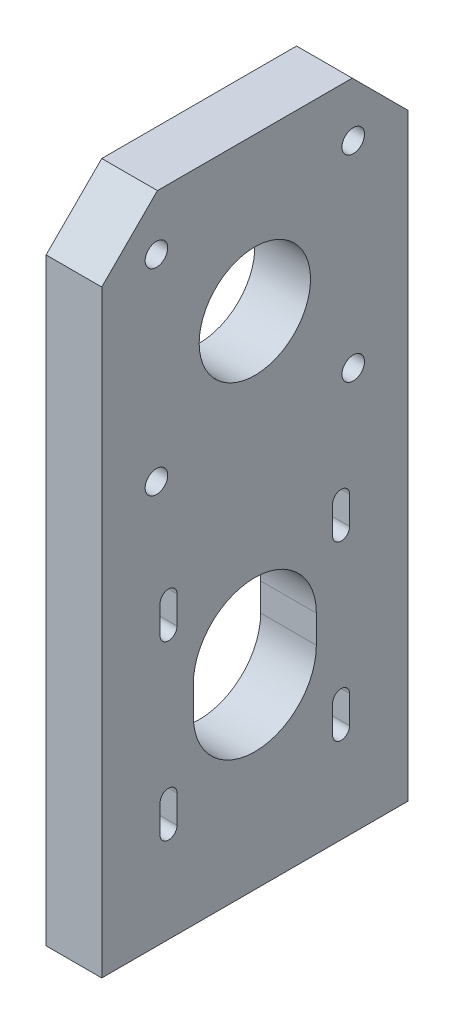
from build123d import *

# Parameters (mm, degrees)
SKETCH_1_R          = 2
SKETCH_1_R_2        = 1.5
SKETCH_1_W          = 10
SKETCH_1_H          = 55
EXTRUDE_1_DEPTH     = 10
SKETCH_2_W          = 10
SKETCH_2_H          = 55
EXTRUDE_2_DEPTH     = 117.5
SKETCH_3_R          = 2.025
SKETCH_3_R_2        = 10
CUT_EXTRUDE_1_DEPTH = 143.543852901
CUT_EXTRUDE_2_DEPTH = 143.543852901
SKETCH_6_W          = 57.5
SKETCH_6_H          = 10
CUT_EXTRUDE_3_DEPTH = 143.060726452
SKETCH_7_R          = 1.65
CUT_EXTRUDE_4_DEPTH = 12


with BuildPart() as part:
    # 草图1 → 凸台-拉伸1 (new body)
    # profile 1 of 3: a face of its own
    with BuildSketch(Plane(origin=(0, 0, 0), x_dir=(1, 0, 0), z_dir=(0, 1, 0))):
        with BuildLine():
            ThreePointArc((0, -27.5), (27.5, 0), (0, 27.5))
            Line((0, 27.5), (-20, 27.5))
            Line((-20, 27.5), (-20, -27.5))
            Line((-20, -27.5), (0, -27.5))
        make_face()
        with Locations(Location((-15, -23.75, 0), (0, 0, 270))):
            Circle(SKETCH_1_R, mode=Mode.SUBTRACT)
        with Locations(Location((-8.876760389, -5.125, 0), (0, 0, 270))):
            Circle(SKETCH_1_R_2, mode=Mode.SUBTRACT)
        with Locations(Location((0, -10.25, 0), (0, 0, 270))):
            Circle(SKETCH_1_R_2, mode=Mode.SUBTRACT)
        with Locations(Location((8.876760389, -5.125, 0), (0, 0, 270))):
            Circle(SKETCH_1_R_2, mode=Mode.SUBTRACT)
        with Locations(Location((-8.876760389, 5.125, 0), (0, 0, 270))):
            Circle(SKETCH_1_R_2, mode=Mode.SUBTRACT)
        with Locations(Location((-15, 23.75, 0), (0, 0, 270))):
            Circle(SKETCH_1_R, mode=Mode.SUBTRACT)
        with Locations(Location((8.876760389, 5.125, 0), (0, 0, 270))):
            Circle(SKETCH_1_R_2, mode=Mode.SUBTRACT)
        with Locations(Location((0, 10.25, 0), (0, 0, 270))):
            Circle(SKETCH_1_R_2, mode=Mode.SUBTRACT)
    # profile 2 of 3: a face of its own
    with BuildSketch(Plane(origin=(0, 0, 0), x_dir=(1, 0, 0), z_dir=(0, 1, 0))):
        with BuildLine():
            ThreePointArc((0, -27.5), (27.5, 0), (0, 27.5))
            Line((0, 27.5), (-20, 27.5))
            Line((-20, 27.5), (-20, -27.5))
            Line((-20, -27.5), (0, -27.5))
        make_face()
        with Locations(Location((-15, -23.75, 0), (0, 0, 270))):
            Circle(SKETCH_1_R, mode=Mode.SUBTRACT)
        with Locations(Location((-8.876760389, -5.125, 0), (0, 0, 270))):
            Circle(SKETCH_1_R_2, mode=Mode.SUBTRACT)
        with Locations(Location((0, -10.25, 0), (0, 0, 270))):
            Circle(SKETCH_1_R_2, mode=Mode.SUBTRACT)
        with Locations(Location((8.876760389, -5.125, 0), (0, 0, 270))):
            Circle(SKETCH_1_R_2, mode=Mode.SUBTRACT)
        with Locations(Location((-8.876760389, 5.125, 0), (0, 0, 270))):
            Circle(SKETCH_1_R_2, mode=Mode.SUBTRACT)
        with Locations(Location((-15, 23.75, 0), (0, 0, 270))):
            Circle(SKETCH_1_R, mode=Mode.SUBTRACT)
        with Locations(Location((8.876760389, 5.125, 0), (0, 0, 270))):
            Circle(SKETCH_1_R_2, mode=Mode.SUBTRACT)
        with Locations(Location((0, 10.25, 0), (0, 0, 270))):
            Circle(SKETCH_1_R_2, mode=Mode.SUBTRACT)
    # profile 3 of 3: a face of its own
    with BuildSketch(Plane(origin=(0, 0, 0), x_dir=(1, 0, 0), z_dir=(0, 1, 0))):
        with Locations((-25, 0)):
            Rectangle(SKETCH_1_W, SKETCH_1_H)
    extrude(amount=EXTRUDE_1_DEPTH)

    # 草图2 → 凸台-拉伸2 (add)
    with BuildSketch(Plane(origin=(0, 10, 0), x_dir=(1, 0, 0), z_dir=(0, 1, 0))):
        with Locations((-25, 0)):
            Rectangle(SKETCH_2_W, SKETCH_2_H)
    extrude(amount=EXTRUDE_2_DEPTH)

    # 草图3 → 切除-拉伸1 (cut, through all)
    with BuildSketch(Plane.ZY.offset(30)):
        with Locations((-17.67766953, 117.67766953)):
            Circle(SKETCH_3_R)
        with Locations((17.67766953, 117.67766953)):
            Circle(SKETCH_3_R)
        with Locations((17.67766953, 82.32233047)):
            Circle(SKETCH_3_R)
        with Locations((-17.67766953, 82.32233047)):
            Circle(SKETCH_3_R)
        with Locations((0, 100)):
            Circle(SKETCH_3_R_2)
        with BuildLine():
            Line((-13.975, 63), (-13.975, 58))
            ThreePointArc((-13.975, 58), (-15.5, 56.475), (-17.025, 58))
            Line((-17.025, 58), (-17.025, 63))
            ThreePointArc((-17.025, 63), (-15.5, 64.525), (-13.975, 63))
        make_face()
        with BuildLine():
            Line((-13.975, 32), (-13.975, 27))
            ThreePointArc((-13.975, 27), (-15.5, 25.475), (-17.025, 27))
            Line((-17.025, 27), (-17.025, 32))
            ThreePointArc((-17.025, 32), (-15.5, 33.525), (-13.975, 32))
        make_face()
        with BuildLine():
            Line((13.975, 63), (13.975, 58))
            ThreePointArc((13.975, 58), (15.5, 56.475), (17.025, 58))
            Line((17.025, 58), (17.025, 63))
            ThreePointArc((17.025, 63), (15.5, 64.525), (13.975, 63))
        make_face()
        with BuildLine():
            Line((13.975, 32), (13.975, 27))
            ThreePointArc((13.975, 27), (15.5, 25.475), (17.025, 27))
            Line((17.025, 27), (17.025, 32))
            ThreePointArc((17.025, 32), (15.5, 33.525), (13.975, 32))
        make_face()
        with BuildLine():
            Line((11.05, 47.5), (11.05, 42.5))
            ThreePointArc((11.05, 42.5), (0, 31.45), (-11.05, 42.5))
            Line((-11.05, 42.5), (-11.05, 47.5))
            ThreePointArc((-11.05, 47.5), (0, 58.55), (11.05, 47.5))
        make_face()
    extrude(amount=-CUT_EXTRUDE_1_DEPTH, mode=Mode.SUBTRACT)

    # 草图5 → 切除-拉伸2 (cut, through all)
    with BuildSketch(Plane.ZY.offset(30)):
        Polygon((-27.5, 117.5), (-17.5, 127.5), (-27.5, 127.5), align=None)
        Polygon((27.5, 117.5), (27.5, 127.5), (17.5, 127.5), align=None)
    extrude(amount=-CUT_EXTRUDE_2_DEPTH, mode=Mode.SUBTRACT)

    # 草图6 → 切除-拉伸3 (cut, through all)
    with BuildSketch(Plane(origin=(0, 0, -27.5), x_dir=(-1, 0, 0), z_dir=(0, 0, -1))):
        with Locations((1.25, 5)):
            Rectangle(SKETCH_6_W, SKETCH_6_H)
    extrude(amount=-CUT_EXTRUDE_3_DEPTH, mode=Mode.SUBTRACT)

    # 草图7 → 切除-拉伸4 (cut)
    with BuildSketch(Plane.XZ.offset(-10)):
        with Locations(Location((-25, 22.5, 0), (0, 0, 270))):
            Circle(SKETCH_7_R)
        with Locations(Location((-25, 7.5, 0), (0, 0, 270))):
            Circle(SKETCH_7_R)
        with Locations(Location((-25, -7.5, 0), (0, 0, 270))):
            Circle(SKETCH_7_R)
        with Locations(Location((-25, -22.5, 0), (0, 0, 270))):
            Circle(SKETCH_7_R)
    extrude(amount=-CUT_EXTRUDE_4_DEPTH, mode=Mode.SUBTRACT)


solid = part.part
